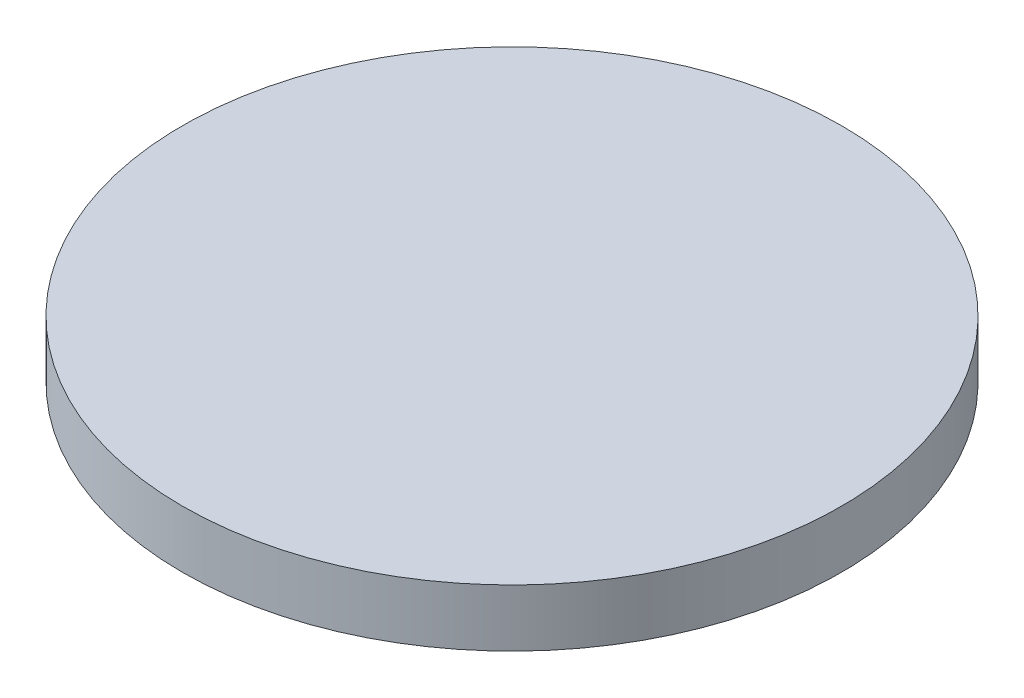
from build123d import *

# Parameters (mm, degrees)
ESQUISSE1_R        = 11.5
BOSS_EXTRU_1_DEPTH = 2


with BuildPart() as part:
    # Esquisse1 → Boss.-Extru.1 (new body)
    with BuildSketch(Plane(origin=(0, 0, 0), x_dir=(1, 0, 0), z_dir=(0, 1, 0))):
        with Locations(Location((0, 0, 0), (0, 0, 270))):
            Circle(ESQUISSE1_R)
    extrude(amount=BOSS_EXTRU_1_DEPTH)


solid = part.part
